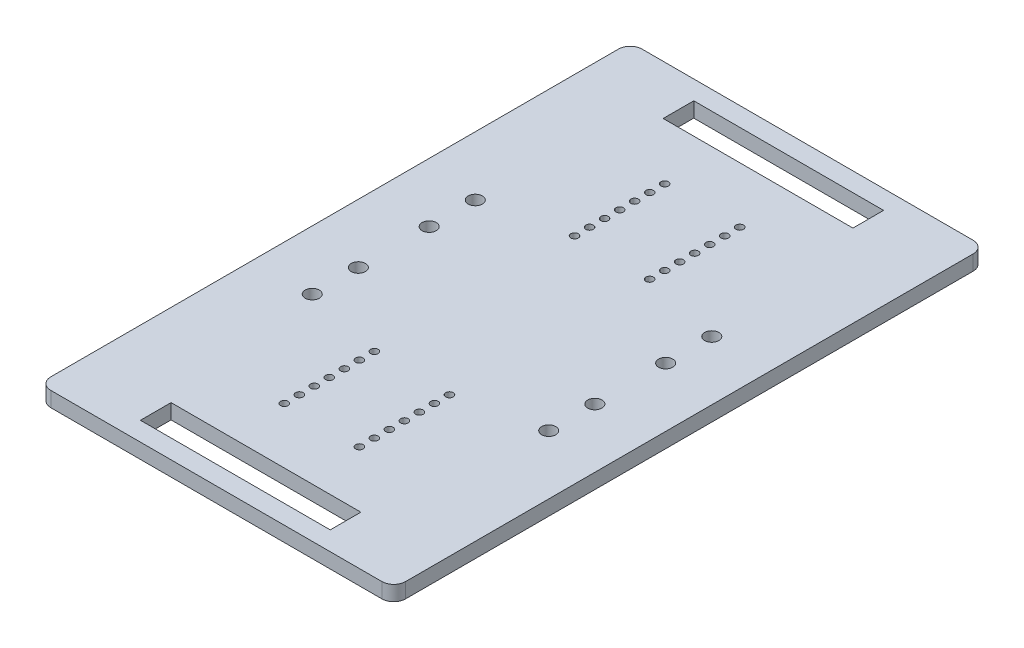
from build123d import *

# Parameters (mm, degrees)
SKETCH1_W           = 150
SKETCH1_H           = 250
BOSS_EXTRUDE1_DEPTH = 6.35
SKETCH2_R           = 1.5875
SKETCH2_W           = 80.264
SKETCH2_H           = 12.954
CUT_EXTRUDE1_DEPTH  = 196.359469952
SKETCH3_R           = 3
CUT_EXTRUDE2_DEPTH  = 196.359469952
FILLET1_R           = 5


with BuildPart() as part:
    # Sketch1 → Boss-Extrude1 (new body)
    with BuildSketch(Plane(origin=(0, 0, 0), x_dir=(1, 0, 0), z_dir=(0, 1, 0))):
        with Locations((75, 0)):
            Rectangle(SKETCH1_W, SKETCH1_H)
    extrude(amount=-BOSS_EXTRUDE1_DEPTH)

    # Sketch2 → Cut-Extrude1 (cut, through all)
    with BuildSketch(Plane(origin=(0, 0, 0), x_dir=(1, 0, 0), z_dir=(0, 1, 0))):
        with Locations(Location((59.125, -80.424, 0), (0, 0, 270))):
            Circle(SKETCH2_R)
        with Locations(Location((59.125, -74.074, 0), (0, 0, 270))):
            Circle(SKETCH2_R)
        with Locations(Location((59.125, -67.724, 0), (0, 0, 270))):
            Circle(SKETCH2_R)
        with Locations(Location((59.125, -61.374, 0), (0, 0, 270))):
            Circle(SKETCH2_R)
        with Locations(Location((59.125, -55.024, 0), (0, 0, 270))):
            Circle(SKETCH2_R)
        with Locations(Location((59.125, -48.674, 0), (0, 0, 270))):
            Circle(SKETCH2_R)
        with Locations(Location((59.125, -42.324, 0), (0, 0, 270))):
            Circle(SKETCH2_R)
        with Locations(Location((90.875, -80.424, 0), (0, 0, 270))):
            Circle(SKETCH2_R)
        with Locations(Location((90.875, -74.074, 0), (0, 0, 270))):
            Circle(SKETCH2_R)
        with Locations(Location((90.875, -67.724, 0), (0, 0, 270))):
            Circle(SKETCH2_R)
        with Locations(Location((90.875, -61.374, 0), (0, 0, 270))):
            Circle(SKETCH2_R)
        with Locations(Location((90.875, -55.024, 0), (0, 0, 270))):
            Circle(SKETCH2_R)
        with Locations(Location((90.875, -48.674, 0), (0, 0, 270))):
            Circle(SKETCH2_R)
        with Locations(Location((90.875, -42.324, 0), (0, 0, 270))):
            Circle(SKETCH2_R)
        with Locations(Location((59.125, 80.424, 0), (0, 0, 270))):
            Circle(SKETCH2_R)
        with Locations(Location((59.125, 74.074, 0), (0, 0, 270))):
            Circle(SKETCH2_R)
        with Locations(Location((59.125, 67.724, 0), (0, 0, 270))):
            Circle(SKETCH2_R)
        with Locations(Location((59.125, 61.374, 0), (0, 0, 270))):
            Circle(SKETCH2_R)
        with Locations(Location((59.125, 55.024, 0), (0, 0, 270))):
            Circle(SKETCH2_R)
        with Locations(Location((59.125, 48.674, 0), (0, 0, 270))):
            Circle(SKETCH2_R)
        with Locations(Location((59.125, 42.324, 0), (0, 0, 270))):
            Circle(SKETCH2_R)
        with Locations(Location((90.875, 80.424, 0), (0, 0, 270))):
            Circle(SKETCH2_R)
        with Locations(Location((90.875, 74.074, 0), (0, 0, 270))):
            Circle(SKETCH2_R)
        with Locations(Location((90.875, 67.724, 0), (0, 0, 270))):
            Circle(SKETCH2_R)
        with Locations(Location((90.875, 61.374, 0), (0, 0, 270))):
            Circle(SKETCH2_R)
        with Locations(Location((90.875, 55.024, 0), (0, 0, 270))):
            Circle(SKETCH2_R)
        with Locations(Location((90.875, 48.674, 0), (0, 0, 270))):
            Circle(SKETCH2_R)
        with Locations(Location((90.875, 42.324, 0), (0, 0, 270))):
            Circle(SKETCH2_R)
        with Locations((75, -110.523)):
            Rectangle(SKETCH2_W, SKETCH2_H)
        with Locations((75, 110.523)):
            Rectangle(SKETCH2_W, SKETCH2_H)
    extrude(amount=-CUT_EXTRUDE1_DEPTH, mode=Mode.SUBTRACT)

    # Sketch3 → Cut-Extrude2 (cut, through all)
    with BuildSketch(Plane(origin=(0, 0, 0), x_dir=(1, 0, 0), z_dir=(0, 1, 0))):
        with Locations(Location((25, -14.975, 0), (0, 0, 270))):
            Circle(SKETCH3_R)
        with Locations(Location((25, -34.475, 0), (0, 0, 270))):
            Circle(SKETCH3_R)
        with Locations(Location((25, 14.975, 0), (0, 0, 270))):
            Circle(SKETCH3_R)
        with Locations(Location((25, 34.475, 0), (0, 0, 270))):
            Circle(SKETCH3_R)
        with Locations(Location((125, -14.975, 0), (0, 0, 270))):
            Circle(SKETCH3_R)
        with Locations(Location((125, -34.475, 0), (0, 0, 270))):
            Circle(SKETCH3_R)
        with Locations(Location((125, 14.975, 0), (0, 0, 270))):
            Circle(SKETCH3_R)
        with Locations(Location((125, 34.475, 0), (0, 0, 270))):
            Circle(SKETCH3_R)
    extrude(amount=-CUT_EXTRUDE2_DEPTH, mode=Mode.SUBTRACT)

    # Fillet1
    fillet1_edges = [part.edges().sort_by_distance(p)[0] for p in [
        (0, -3.175, -125),
        (150, -3.175, -125),
        (150, -3.175, 125),
        (0, -3.175, 125),
    ]]
    fillet(fillet1_edges, radius=FILLET1_R)


solid = part.part
